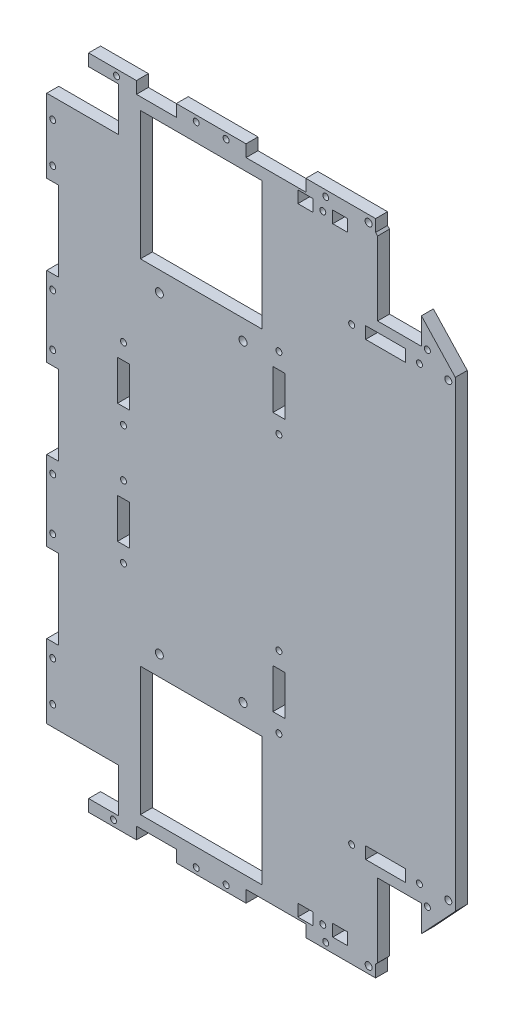
from build123d import *

# Parameters (mm, degrees)
ESQUISSE1_W                     = 205
ESQUISSE1_H                     = 330
BOSS_EXTRU_1_DEPTH              = 6
ESQUISSE2_W                     = 20
ESQUISSE2_H                     = 6
ROULEMENT_ENCOCHE_INTERNE_DEPTH = 389.536999525
ESQUISSE3_W                     = 30
ESQUISSE3_H                     = 6
ESQUISSE3_W_2                   = 6
ESQUISSE3_H_2                   = 40
ESQUISSE3_W_3                   = 20
ENL_V_MAT_ENCOCHE_DEPTH         = 389.536999525
ESQUISSE6_R                     = 2
ESQUISSE6_W                     = 61
ESQUISSE6_H                     = 64.5
ESQUISSE6_W_2                   = 6
ESQUISSE6_H_2                   = 20
BLOC_MOTEUR_DEPTH               = 389.536999525
ESQUISSE7_R                     = 1.5
ESQUISSE7_R_2                   = 1.75
ENL_V_MAT_EXTRU_4_DEPTH         = 389.536999525
ESQUISSE8_R                     = 2.995
ESQUISSE8_R_2                   = 4
ESQUISSE8_R_3                   = 3.495
ESQUISSE8_R_4                   = 3
ENL_V_MAT_EXTRU_7_DEPTH         = 3
ESQUISSE9_R                     = 1.5
ESQUISSE9_W                     = 22
ESQUISSE9_H                     = 36.925
ESQUISSE9_W_2                   = 7.5
ESQUISSE9_H_2                   = 6
ENL_V_MAT_EXTRU_8_DEPTH         = 389.536999525
ESQUISSE10_R                    = 2.995
ENL_V_MAT_EXTRU_9_DEPTH         = 3


with BuildPart() as part:
    # Esquisse1 → Boss.-Extru.1 (new body)
    with BuildSketch(Plane.XY):
        with Locations((-102.5, 165)):
            Rectangle(ESQUISSE1_W, ESQUISSE1_H)
    extrude(amount=BOSS_EXTRU_1_DEPTH)

    # Esquisse2 → roulement + encoche interne (cut, through all)
    with BuildSketch(Plane.XY.offset(6)):
        with Locations((-35, 278)):
            Rectangle(ESQUISSE2_W, ESQUISSE2_H)
        with Locations((-35, 52)):
            Rectangle(ESQUISSE2_W, ESQUISSE2_H)
    extrude(amount=-ROULEMENT_ENCOCHE_INTERNE_DEPTH, mode=Mode.SUBTRACT)

    # Esquisse3 → Enlèv. mat encoche (cut, through all)
    with BuildSketch(Plane.XY.offset(6)):
        Polygon((0, 330), (-40, 330), (-40, 324), (0, 281), align=None)
        Polygon((-40, 0), (-40, 6), (0, 49), (0, 0), align=None)
        with Locations((-90, 3)):
            Rectangle(ESQUISSE3_W, ESQUISSE3_H)
        with Locations((-202, 165)):
            Rectangle(ESQUISSE3_W_2, ESQUISSE3_H_2)
        with Locations((-202, 85)):
            Rectangle(ESQUISSE3_W_2, ESQUISSE3_H_2)
        with Locations((-90, 327)):
            Rectangle(ESQUISSE3_W, ESQUISSE3_H)
        Polygon((-205, 302), (-169, 302), (-169, 324), (-184, 324), (-184, 330), (-205, 330), align=None)
        with Locations((-202, 245)):
            Rectangle(ESQUISSE3_W_2, ESQUISSE3_H_2)
        with Locations((-150, 3)):
            Rectangle(ESQUISSE3_W_3, ESQUISSE3_H)
        with Locations((-150, 327)):
            Rectangle(ESQUISSE3_W_3, ESQUISSE3_H)
        Polygon((-205, 0), (-205, 28), (-169, 28), (-169, 6), (-184, 6), (-184, 0), align=None)
    extrude(amount=-ENL_V_MAT_ENCOCHE_DEPTH, mode=Mode.SUBTRACT)

    # Esquisse6 → bloc moteur (cut, through all)
    with BuildSketch(Plane.XY.offset(6)):
        with Locations((-148.5, 243.5)):
            Circle(ESQUISSE6_R)
        with Locations(Location((-106.5, 243.5, 0), (0, 0, 180))):
            Circle(ESQUISSE6_R)
        with Locations((-106.5, 86.5)):
            Circle(ESQUISSE6_R)
        with Locations(Location((-148.5, 86.5, 0), (0, 0, 180))):
            Circle(ESQUISSE6_R)
        with Locations((-127.5, 285.75)):
            Rectangle(ESQUISSE6_W, ESQUISSE6_H)
        with Locations((-88.5, 100)):
            Rectangle(ESQUISSE6_W_2, ESQUISSE6_H_2)
        with Locations((-166.5, 135)):
            Rectangle(ESQUISSE6_W_2, ESQUISSE6_H_2)
        with Locations((-127.5, 44.25)):
            Rectangle(ESQUISSE6_W, ESQUISSE6_H)
        with Locations((-166.5, 195)):
            Rectangle(ESQUISSE6_W_2, ESQUISSE6_H_2)
        with Locations((-88.5, 230)):
            Rectangle(ESQUISSE6_W_2, ESQUISSE6_H_2)
    extrude(amount=-BLOC_MOTEUR_DEPTH, mode=Mode.SUBTRACT)

    # Esquisse7 → Enlèv. mat.-Extru.4 (cut, through all)
    with BuildSketch(Plane.XY.offset(6)):
        with Locations((-65, 3)):
            Circle(ESQUISSE7_R)
        with Locations((-171.504166956, 3)):
            Circle(ESQUISSE7_R)
        with Locations((-115, 3)):
            Circle(ESQUISSE7_R)
        with Locations((-202, 58)):
            Circle(ESQUISSE7_R)
        with Locations((-202, 272)):
            Circle(ESQUISSE7_R)
        with Locations((-65, 327)):
            Circle(ESQUISSE7_R)
        with Locations((-170, 327)):
            Circle(ESQUISSE7_R)
        with Locations((-18, 52)):
            Circle(ESQUISSE7_R)
        with Locations((-52, 52)):
            Circle(ESQUISSE7_R)
        with Locations((-18, 278)):
            Circle(ESQUISSE7_R)
        with Locations((-52, 278)):
            Circle(ESQUISSE7_R)
        with Locations((-202, 112)):
            Circle(ESQUISSE7_R)
        with Locations((-202, 138)):
            Circle(ESQUISSE7_R)
        with Locations((-166.5, 117)):
            Circle(ESQUISSE7_R)
        with Locations((-130, 327)):
            Circle(ESQUISSE7_R)
        with Locations((-202, 192)):
            Circle(ESQUISSE7_R)
        with Locations((-202, 218)):
            Circle(ESQUISSE7_R)
        with Locations((-166.5, 153)):
            Circle(ESQUISSE7_R)
        with Locations((-130, 3)):
            Circle(ESQUISSE7_R)
        with Locations((-115, 327)):
            Circle(ESQUISSE7_R)
        with Locations((-202, 292)):
            Circle(ESQUISSE7_R)
        with Locations((-202, 38)):
            Circle(ESQUISSE7_R)
        with Locations((-43.5, 326.5)):
            Circle(ESQUISSE7_R_2)
        with Locations((-3.5, 278)):
            Circle(ESQUISSE7_R_2)
        with Locations((-3.5, 52)):
            Circle(ESQUISSE7_R_2)
        with Locations((-43.5, 3.5)):
            Circle(ESQUISSE7_R_2)
        with Locations((-88.5, 82)):
            Circle(ESQUISSE7_R)
        with Locations((-88.5, 118)):
            Circle(ESQUISSE7_R)
        with Locations((-14, 44)):
            Circle(ESQUISSE7_R)
        with Locations((-14, 286)):
            Circle(ESQUISSE7_R)
        with Locations(Location((-88.5, 212, 0), (0, 0, 180))):
            Circle(ESQUISSE7_R)
        with Locations(Location((-88.5, 248, 0), (0, 0, 180))):
            Circle(ESQUISSE7_R)
        with Locations(Location((-166.5, 177, 0), (0, 0, 180))):
            Circle(ESQUISSE7_R)
        with Locations(Location((-166.5, 213, 0), (0, 0, 180))):
            Circle(ESQUISSE7_R)
    extrude(amount=-ENL_V_MAT_EXTRU_4_DEPTH, mode=Mode.SUBTRACT)

    # Esquisse8 → Enlèv. mat.-Extru.7 (cut)
    with BuildSketch(Plane(origin=(0, 0, 0), x_dir=(-1, 0, 0), z_dir=(0, 0, -1))):
        with Locations((14, 44)):
            Circle(ESQUISSE8_R)
        with Locations((170, 327)):
            Circle(ESQUISSE8_R)
        with Locations((202, 292)):
            Circle(ESQUISSE8_R)
        with Locations((202, 272)):
            Circle(ESQUISSE8_R)
        with Locations((202, 218)):
            Circle(ESQUISSE8_R)
        with Locations((202, 192)):
            Circle(ESQUISSE8_R)
        with Locations((130, 327)):
            Circle(ESQUISSE8_R)
        with Locations((115, 327)):
            Circle(ESQUISSE8_R)
        with Locations((65, 327)):
            Circle(ESQUISSE8_R)
        with Locations((52, 278)):
            Circle(ESQUISSE8_R)
        with Locations((18, 278)):
            Circle(ESQUISSE8_R)
        with Locations((148.5, 243.5)):
            Circle(ESQUISSE8_R_2)
        with Locations((106.5, 243.5)):
            Circle(ESQUISSE8_R_2)
        with Locations(Location((106.5, 86.5, 0), (0, 0, 180))):
            Circle(ESQUISSE8_R_2)
        with Locations(Location((148.5, 86.5, 0), (0, 0, 180))):
            Circle(ESQUISSE8_R_2)
        with Locations((3.5, 278)):
            Circle(ESQUISSE8_R_3)
        with Locations(Location((52, 52, 0), (0, 0, 180))):
            Circle(ESQUISSE8_R)
        with Locations(Location((18, 52, 0), (0, 0, 180))):
            Circle(ESQUISSE8_R)
        with Locations(Location((65, 3, 0), (0, 0, 180))):
            Circle(ESQUISSE8_R)
        with Locations(Location((115, 3, 0), (0, 0, 180))):
            Circle(ESQUISSE8_R)
        with Locations(Location((130, 3, 0), (0, 0, 180))):
            Circle(ESQUISSE8_R)
        with Locations((171.504166956, 3)):
            Circle(ESQUISSE8_R)
        with Locations((14, 286)):
            Circle(ESQUISSE8_R)
        with Locations(Location((202, 38, 0), (0, 0, 180))):
            Circle(ESQUISSE8_R)
        with Locations(Location((202, 58, 0), (0, 0, 180))):
            Circle(ESQUISSE8_R)
        with Locations(Location((202, 112, 0), (0, 0, 180))):
            Circle(ESQUISSE8_R)
        with Locations(Location((202, 138, 0), (0, 0, 180))):
            Circle(ESQUISSE8_R)
        with Locations((88.5, 212)):
            Circle(ESQUISSE8_R_4)
        with Locations((88.5, 248)):
            Circle(ESQUISSE8_R_4)
        with Locations((166.5, 177)):
            Circle(ESQUISSE8_R_4)
        with Locations((166.5, 213)):
            Circle(ESQUISSE8_R_4)
        with Locations(Location((166.5, 117, 0), (0, 0, 180))):
            Circle(ESQUISSE8_R_4)
        with Locations(Location((166.5, 153, 0), (0, 0, 180))):
            Circle(ESQUISSE8_R_4)
        with Locations(Location((88.5, 82, 0), (0, 0, 180))):
            Circle(ESQUISSE8_R_4)
        with Locations(Location((88.5, 118, 0), (0, 0, 180))):
            Circle(ESQUISSE8_R_4)
        with Locations((43.5, 326.5)):
            Circle(ESQUISSE8_R_3)
        with Locations((43.5, 3.5)):
            Circle(ESQUISSE8_R_3)
        with Locations((3.5, 52)):
            Circle(ESQUISSE8_R_3)
    extrude(amount=-ENL_V_MAT_EXTRU_7_DEPTH, mode=Mode.SUBTRACT)

    # Esquisse9 → Enlèv. mat.-Extru.8 (cut, through all)
    with BuildSketch(Plane.XY.offset(6)):
        with Locations((-66.5, 10)):
            Circle(ESQUISSE9_R)
        with Locations(Location((-66.5, 320, 0), (0, 0, 180))):
            Circle(ESQUISSE9_R)
        with Locations((-28, 25.5375)):
            Rectangle(ESQUISSE9_W, ESQUISSE9_H)
        with Locations((-75.25, 10)):
            Rectangle(ESQUISSE9_W_2, ESQUISSE9_H_2)
        with Locations((-57.75, 10)):
            Rectangle(ESQUISSE9_W_2, ESQUISSE9_H_2)
        with Locations((-57.75, 320)):
            Rectangle(ESQUISSE9_W_2, ESQUISSE9_H_2)
        with Locations((-75.25, 320)):
            Rectangle(ESQUISSE9_W_2, ESQUISSE9_H_2)
        with Locations((-28, 304.4625)):
            Rectangle(ESQUISSE9_W, ESQUISSE9_H)
    extrude(amount=-ENL_V_MAT_EXTRU_8_DEPTH, mode=Mode.SUBTRACT)

    # Esquisse10 → Enlèv. mat.-Extru.9 (cut)
    with BuildSketch(Plane(origin=(0, 0, 0), x_dir=(-1, 0, 0), z_dir=(0, 0, -1))):
        with Locations((66.5, 320)):
            Circle(ESQUISSE10_R)
        with Locations((66.5, 10)):
            Circle(ESQUISSE10_R)
    extrude(amount=-ENL_V_MAT_EXTRU_9_DEPTH, mode=Mode.SUBTRACT)


solid = part.part
